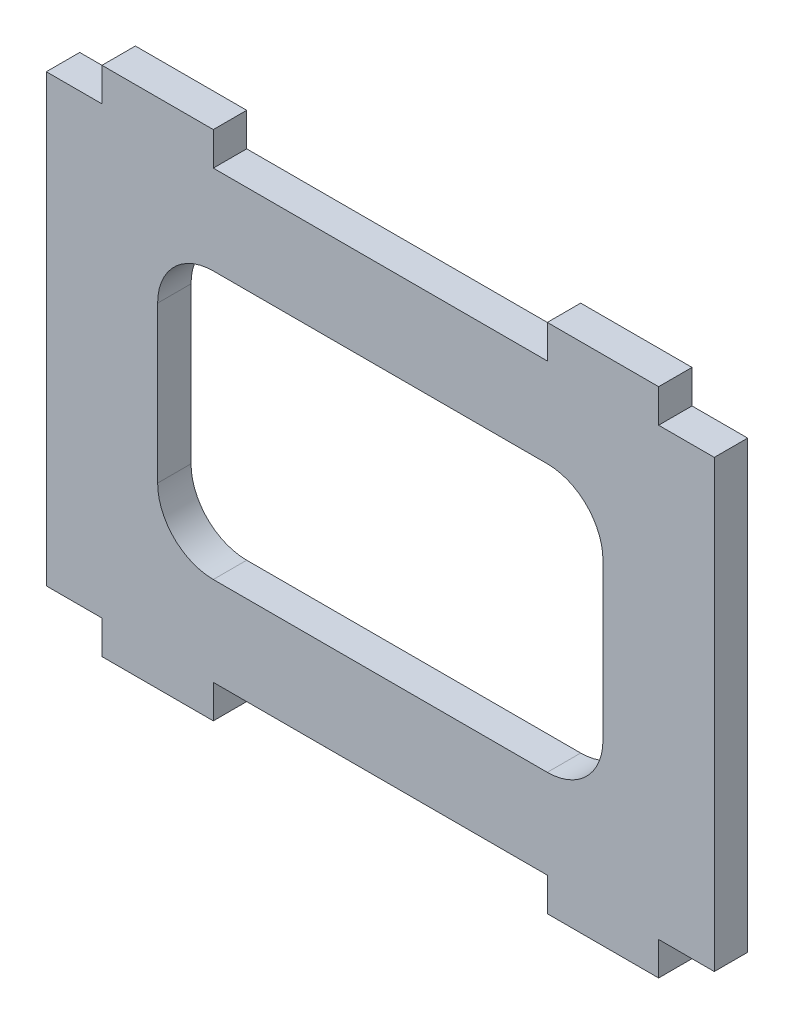
from build123d import *

# Parameters (mm, degrees)
BOSS_EXTRU_1_DEPTH      = 3
ENL_V_MAT_EXTRU_1_DEPTH = 58.384666942


with BuildPart() as part:
    # Esquisse1 → Boss.-Extru.1 (new body)
    with BuildSketch(Plane.XY):
        Polygon((-5, -25), (-5, -28), (5, -28), (5, -25), (20, -25), (20, 15), (5, 15), (5, 18), (-5, 18), (-5, 15), (-10, 15), (-10, -25), align=None)
    extrude(amount=BOSS_EXTRU_1_DEPTH)

    # Symétrie1: part across plane


with BuildPart() as part_1:
    add(part.part)
    add(part.part.mirror(Plane(origin=(20, 15, 3), x_dir=(0, 0, 1), z_dir=(-1, 0, 0))))

    # Esquisse2 → Enlèv. mat.-Extru.1 (cut, through all)
    with BuildSketch(Plane.XY.offset(3)):
        with BuildLine():
            Line((5, 7), (35, 7))
            ThreePointArc((35, 7), (38.535533906, 5.535533906), (40, 2))
            Line((40, 2), (40, -12))
            ThreePointArc((40, -12), (38.535533906, -15.535533906), (35, -17))
            Line((35, -17), (5, -17))
            ThreePointArc((5, -17), (1.464466094, -15.535533906), (0, -12))
            Line((0, -12), (0, 2))
            ThreePointArc((0, 2), (1.464466094, 5.535533906), (5, 7))
        make_face()
    extrude(amount=-ENL_V_MAT_EXTRU_1_DEPTH, mode=Mode.SUBTRACT)


solid = part_1.part
